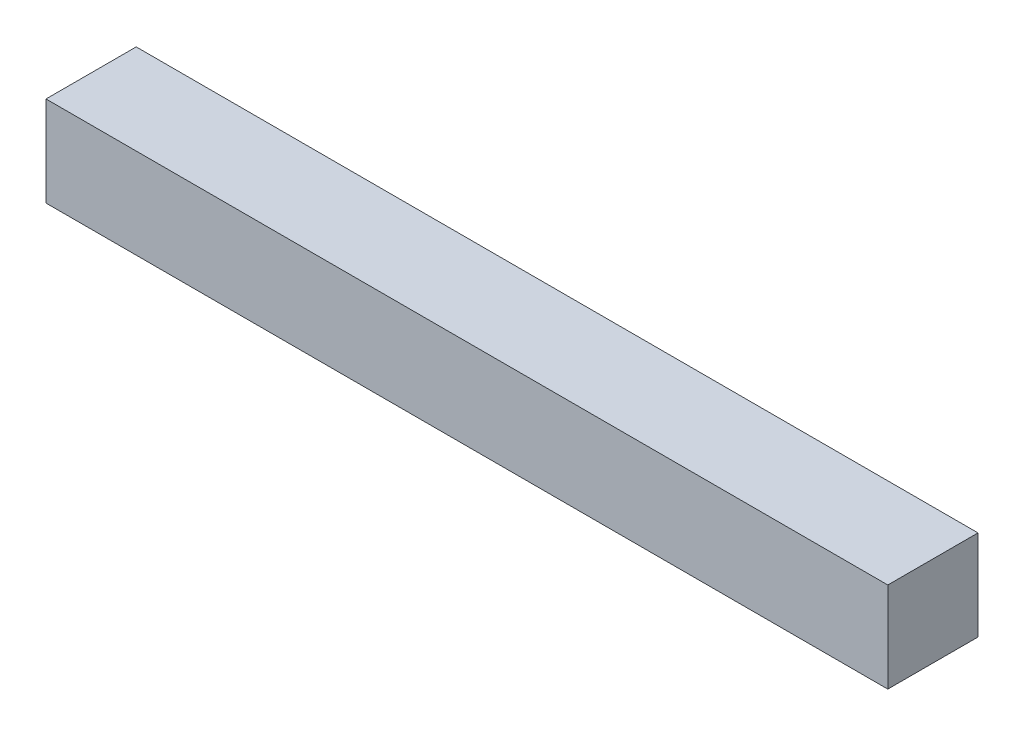
from build123d import *

# Parameters (mm, degrees)
KAPYAG_ON_CEKME_DUDAGI_1_START = -5
SKETCH1_W                      = 140
SKETCH1_H                      = 15
KAPYAG_ON_CEKME_DUDAGI_1_DEPTH = 15


with BuildPart() as part:
    # Sketch1 → KAPYAG_on_cekme_dudagi_1 (new body)
    with BuildSketch(Plane.XY.offset(KAPYAG_ON_CEKME_DUDAGI_1_START)):
        with Locations((0, 252.5)):
            Rectangle(SKETCH1_W, SKETCH1_H)
    extrude(amount=-KAPYAG_ON_CEKME_DUDAGI_1_DEPTH)


solid = part.part
